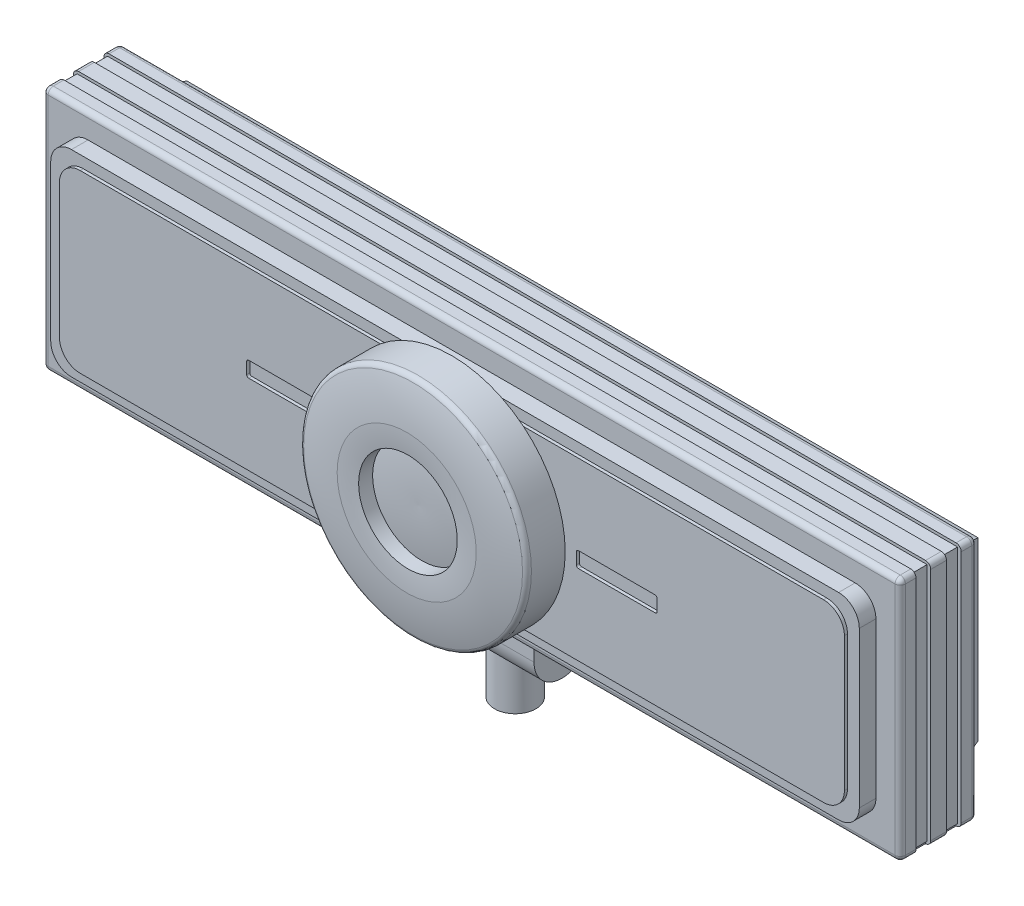
from build123d import *

# Parameters (mm, degrees)
SKETCH1_W           = 105.029
SKETCH1_H           = 30.0482
BOSS_EXTRUDE1_DEPTH = 1.9304
SKETCH2_W           = 104.14
SKETCH2_H           = 29.3624
BOSS_EXTRUDE2_DEPTH = 1.9304
LPATTERN1_COUNT     = 2
LPATTERN1_PITCH     = 3.7338
LPATTERN2_COUNT     = 2
LPATTERN2_PITCH     = 7.4676
FILLET1_R           = 0.635
SKETCH7_W           = 103.759
SKETCH7_H           = 5.5372
BOSS_EXTRUDE3_DEPTH = 0.3429
BOSS_EXTRUDE4_DEPTH = 2.032
BOSS_EXTRUDE5_DEPTH = 0.381
FILLET2_R           = 0.635
CUT_EXTRUDE1_DEPTH  = 0.381
BOSS_EXTRUDE6_DEPTH = 5.715
SKETCH18_R          = 2.54
BOSS_EXTRUDE7_DEPTH = 11.176


with BuildPart() as part:
    # Sketch1 → Boss-Extrude1 (new body)
    with BuildSketch(Plane.XY):
        Rectangle(SKETCH1_W, SKETCH1_H)
    boss_extrude1 = extrude(amount=BOSS_EXTRUDE1_DEPTH)

    # Sketch2 → Boss-Extrude2 (add)
    with BuildSketch(Plane.XY.offset(1.9304)):
        Rectangle(SKETCH2_W, SKETCH2_H)
    boss_extrude2 = extrude(amount=BOSS_EXTRUDE2_DEPTH)

    # LPattern1: Boss-Extrude1, Boss-Extrude2 ×2
    with Locations(*[(0, 0, i * LPATTERN1_PITCH) for i in range(1, LPATTERN1_COUNT)]):
        add(boss_extrude1)
        add(boss_extrude2)

    # LPattern2: Boss-Extrude1 ×2
    with Locations(*[(0, 0, i * LPATTERN2_PITCH) for i in range(1, LPATTERN2_COUNT)]):
        add(boss_extrude1)

    # Sketch4 → Loft1 section 0
    with BuildSketch(Plane(origin=(0, 0, 0), x_dir=(-1, 0, 0), z_dir=(0, 0, -1))):
        with BuildLine():
            Line((-49.4538, -11.938), (49.4538, -11.938))
            Line((49.4538, -11.938), (49.4538, 11.938))
            Line((49.4538, 11.938), (-49.4538, 11.938))
            Line((-49.4538, 11.938), (-49.4538, -11.938))
        make_face()
    # Sketch5 → Loft1 section 1
    with BuildSketch(Plane(origin=(0, 0, -4.191), x_dir=(-1, 0, 0), z_dir=(0, 0, -1))):
        with BuildLine():
            Line((-48.4505, -10.795), (48.4505, -10.795))
            Line((48.4505, -10.795), (48.4505, 10.795))
            Line((48.4505, 10.795), (-48.4505, 10.795))
            Line((-48.4505, 10.795), (-48.4505, -10.795))
        make_face()
    loft()

    # Fillet1
    fillet1_edges = [part.edges().sort_by_distance(p)[0] for p in [
        (52.5145, -15.0241, 4.699),
        (52.5145, 15.0241, 4.699),
        (-52.5145, 15.0241, 4.699),
        (-52.5145, -15.0241, 4.699),
        (0, -15.0241, 0),
        (-52.5145, 0, 0),
        (0, 15.0241, 0),
        (52.5145, 0, 0),
        (52.5145, -15.0241, 8.4328),
        (52.5145, 15.0241, 8.4328),
        (-52.5145, 15.0241, 8.4328),
        (-52.5145, -15.0241, 8.4328),
        (52.5145, 0, 9.398),
        (0, 15.0241, 9.398),
        (-52.5145, 0, 9.398),
        (0, -15.0241, 9.398),
        (52.5145, -15.0241, 0.9652),
        (-52.5145, -15.0241, 0.9652),
        (-52.5145, 15.0241, 0.9652),
        (52.5145, 15.0241, 0.9652),
    ]]
    fillet(fillet1_edges, radius=FILLET1_R)

    # Sketch7 → Boss-Extrude3 (add)
    with BuildSketch(Plane.XZ.offset(14.6812)):
        with Locations((0, 4.699)):
            Rectangle(SKETCH7_W, SKETCH7_H)
    extrude(amount=BOSS_EXTRUDE3_DEPTH)

    # Sketch8 → Boss-Extrude4 (add)
    with BuildSketch(Plane.XY.offset(9.398)):
        with BuildLine():
            Line((-46.99, -12.065), (46.99, -12.065))
            ThreePointArc((46.99, -12.065), (48.786051224, -11.321051224), (49.53, -9.525))
            Line((49.53, -9.525), (49.53, 9.525))
            ThreePointArc((49.53, 9.525), (48.786051224, 11.321051224), (46.99, 12.065))
            Line((46.99, 12.065), (-46.99, 12.065))
            ThreePointArc((-46.99, 12.065), (-48.786051224, 11.321051224), (-49.53, 9.525))
            Line((-49.53, 9.525), (-49.53, -9.525))
            ThreePointArc((-49.53, -9.525), (-48.786051224, -11.321051224), (-46.99, -12.065))
        make_face()
    extrude(amount=BOSS_EXTRUDE4_DEPTH)

    # Sketch9 → Boss-Extrude5 (add)
    with BuildSketch(Plane.XY.offset(11.43)):
        with BuildLine():
            Line((-45.5422, -10.7569), (45.5422, -10.7569))
            ThreePointArc((45.5422, -10.7569), (47.338251224, -10.012951224), (48.0822, -8.2169))
            Line((48.0822, -8.2169), (48.0822, 8.2169))
            ThreePointArc((48.0822, 8.2169), (47.338251224, 10.012951224), (45.5422, 10.7569))
            Line((45.5422, 10.7569), (-45.5422, 10.7569))
            ThreePointArc((-45.5422, 10.7569), (-47.338251224, 10.012951224), (-48.0822, 8.2169))
            Line((-48.0822, 8.2169), (-48.0822, -8.2169))
            ThreePointArc((-48.0822, -8.2169), (-47.338251224, -10.012951224), (-45.5422, -10.7569))
        make_face()
    extrude(amount=BOSS_EXTRUDE5_DEPTH)

    # Sketch11 → Revolve2 (revolve)
    with BuildSketch(Plane(origin=(0, 0, 0), x_dir=(1, 0, 0), z_dir=(0, 1, 0)), mode=Mode.PRIVATE) as revolve2_sk:
        with BuildLine():
            Line((6.0452, -11.811), (0, -11.811))
            Line((0, -11.811), (0, -15.875))
            add(Edge.make_bspline(
                [(0, -15.875), (3.043594476, -15.975265485), (6.0452, -15.481521135)],
                knots=[0, 0, 0, 1, 1, 1], degree=2))
            Line((6.0452, -15.481521135), (6.0452, -11.811))
        make_face()
        with BuildLine():
            Line((8.5217, -11.811), (6.0452, -11.811))
            Line((6.0452, -11.811), (6.0452, -15.481521135))
            Line((6.0452, -15.481521135), (6.0452, -17.1958))
            add(Edge.make_bspline(
                [(8.5217, -17.3482), (7.278684306, -17.344923814), (6.0452, -17.1958)],
                knots=[0, 0, 0, 1, 1, 1], degree=2))
            Line((8.5217, -17.3482), (8.5217, -11.811))
        make_face()
        with BuildLine():
            Line((13.8811, -11.811), (8.5217, -11.811))
            Line((8.5217, -11.811), (8.5217, -17.3482))
            add(Edge.make_bspline(
                [(8.5217, -17.3482), (11.251543816, -17.184044581), (13.8811, -16.4338)],
                knots=[0, 0, 0, 1, 1, 1], degree=2))
            Line((13.8811, -16.4338), (13.8811, -11.811))
        make_face()
    revolve(revolve2_sk.sketch.rotate(Axis((0, 0, 11.811), (0, 0, 1)), 180), axis=Axis((0, 0, 11.811), (0, 0, 1)))

    # Fillet2
    fillet2_edges = [part.edges().sort_by_distance(p)[0] for p in [
        (13.8811, 0, 16.4338),
    ]]
    fillet(fillet2_edges, radius=FILLET2_R)

    # Sketch15 → Cut-Extrude1 (cut)
    with BuildSketch(Plane.XY.offset(11.811)):
        with BuildLine():
            Line((15.494, -0.9525), (24.892, -0.9525))
            ThreePointArc((24.892, -0.9525), (25.071605122, -0.878105122), (25.146, -0.6985))
            Line((25.146, -0.6985), (25.146, 0.6985))
            ThreePointArc((25.146, 0.6985), (25.071605122, 0.878105122), (24.892, 0.9525))
            Line((24.892, 0.9525), (15.494, 0.9525))
            ThreePointArc((15.494, 0.9525), (15.314394878, 0.878105122), (15.24, 0.6985))
            Line((15.24, 0.6985), (15.24, -0.6985))
            ThreePointArc((15.24, -0.6985), (15.314394878, -0.878105122), (15.494, -0.9525))
        make_face()
        with BuildLine():
            Line((-25.146, -0.6985), (-25.146, 0.6985))
            ThreePointArc((-25.146, 0.6985), (-25.071605122, 0.878105122), (-24.892, 0.9525))
            Line((-24.892, 0.9525), (-15.494, 0.9525))
            ThreePointArc((-15.494, 0.9525), (-15.314394878, 0.878105122), (-15.24, 0.6985))
            Line((-15.24, 0.6985), (-15.24, -0.6985))
            ThreePointArc((-15.24, -0.6985), (-15.314394878, -0.878105122), (-15.494, -0.9525))
            Line((-15.494, -0.9525), (-24.892, -0.9525))
            ThreePointArc((-24.892, -0.9525), (-25.071605122, -0.878105122), (-25.146, -0.6985))
        make_face()
    extrude(amount=-CUT_EXTRUDE1_DEPTH, mode=Mode.SUBTRACT)

    # Sketch16 → Boss-Extrude6 (add, symmetric)
    with BuildSketch(Plane(origin=(0, 0, 0), x_dir=(0, 0, -1), z_dir=(1, 0, 0))):
        with BuildLine():
            Line((-0.635, -15.0241), (-7.4676, -15.0241))
            Line((-7.4676, -15.0241), (-7.4676, -17.9578))
            ThreePointArc((-7.4676, -17.9578), (-4.0513, -21.3741), (-0.635, -17.9578))
            Line((-0.635, -17.9578), (-0.635, -15.0241))
        make_face()
    extrude(amount=BOSS_EXTRUDE6_DEPTH, both=True)

    # Sketch18 → Boss-Extrude7 (add)
    with BuildSketch(Plane(origin=(0, -15.0241, 0), x_dir=(-1, 0, 0), z_dir=(0, -1, 0))):
        with Locations(Location((0, -4.0513, 0), (0, 0, 270))):
            Circle(SKETCH18_R)
    extrude(amount=BOSS_EXTRUDE7_DEPTH)

    # Sketch20 → Revolve4 (revolve)
    with BuildSketch(Plane(origin=(0, 0, 0), x_dir=(0, 0, -1), z_dir=(1, 0, 0)), mode=Mode.PRIVATE) as revolve4_sk:
        Polygon((4.191, 0), (11.684, 0), (11.684, 3.175), (8.2804, 3.175), (4.191, 6.604), align=None)
    revolve(revolve4_sk.sketch.rotate(Axis((0, 0, 24.542527364), (0, 0, 1)), 270), axis=Axis((0, 0, 24.542527364), (0, 0, 1)))


with BuildPart() as body_2:
    # Sketch14 → Revolve3 (revolve)
    with BuildSketch(Plane(origin=(0, 0, 0), x_dir=(1, 0, 0), z_dir=(0, 1, 0))):
        with BuildLine():
            Line((0, -14.1732), (0, -11.811))
            Line((0, -11.811), (2.3622, -11.811))
            ThreePointArc((2.3622, -11.811), (1.670327639, -13.481327639), (0, -14.1732))
        make_face()
    revolve(axis=Axis((0, 0, -30.038958129), (0, 0, 1)))


solid = Compound([part.part, body_2.part])
